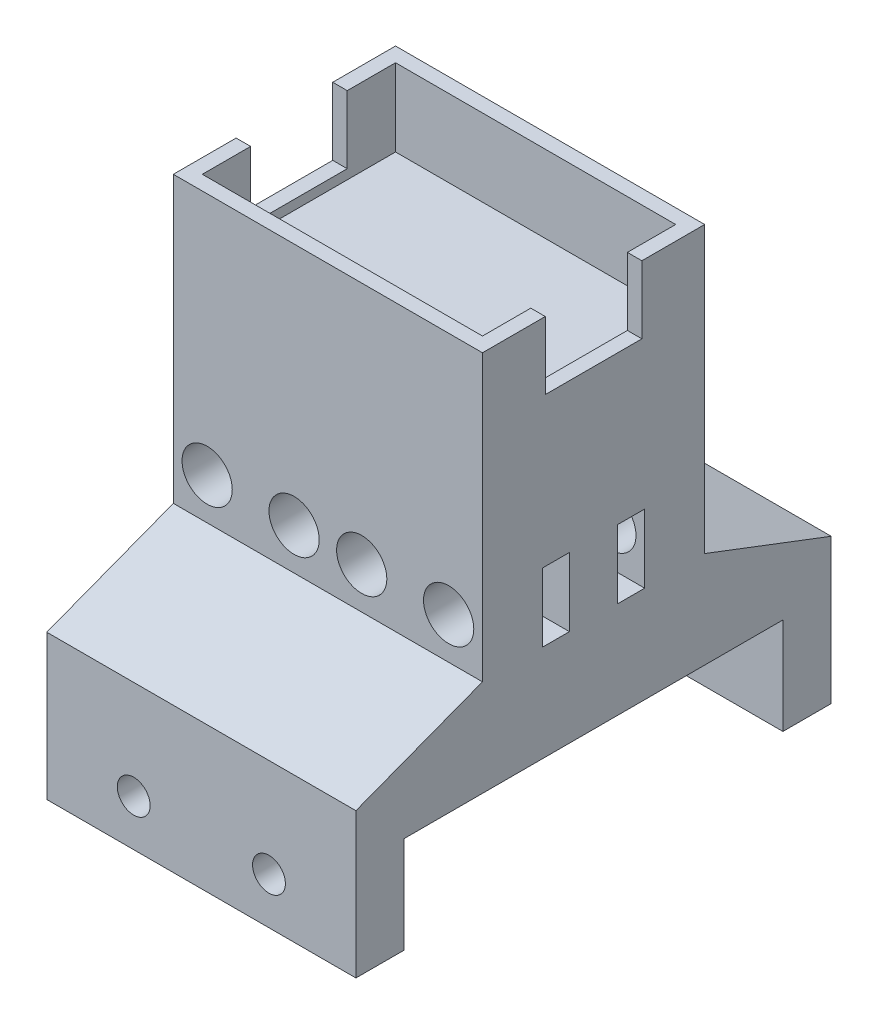
from build123d import *

# Parameters (mm, degrees)
SKETCH4_W           = 32
SKETCH4_H           = 23
BOSS_EXTRUDE3_DEPTH = 19.5
SKETCH5_W           = 29
SKETCH5_H           = 20
CUT_EXTRUDE2_DEPTH  = 8
SKETCH7_W           = 10
SKETCH7_H           = 7
CUT_EXTRUDE4_DEPTH  = 40.198214245
SKETCH8_W           = 32
SKETCH8_H           = 23
BOSS_EXTRUDE4_DEPTH = 10
SKETCH12_R          = 2.6
CUT_EXTRUDE5_DEPTH  = 7
CIRPATTERN1_COUNT   = 2
CIRPATTERN1_ANGLE   = 180
SKETCH13_W          = 15
SKETCH13_H          = 2.791622882
CUT_EXTRUDE6_DEPTH  = 7.1
SKETCH14_W          = 32
SKETCH14_H          = 23
BOSS_EXTRUDE5_DEPTH = 5
BOSS_EXTRUDE6_DEPTH = 32
SKETCH16_R          = 1.7
CUT_EXTRUDE7_DEPTH  = 60.805016512


with BuildPart() as part:
    # Sketch4 → Boss-Extrude3 (new body)
    with BuildSketch(Plane(origin=(0, 0, 0), x_dir=(1, 0, 0), z_dir=(0, 1, 0))):
        Rectangle(SKETCH4_W, SKETCH4_H)
    extrude(amount=BOSS_EXTRUDE3_DEPTH)

    # Sketch5 → Cut-Extrude2 (cut)
    with BuildSketch(Plane(origin=(0, 19.5, 0), x_dir=(1, 0, 0), z_dir=(0, 1, 0))):
        Rectangle(SKETCH5_W, SKETCH5_H)
    extrude(amount=-CUT_EXTRUDE2_DEPTH, mode=Mode.SUBTRACT)

    # Sketch7 → Cut-Extrude4 (cut, through all)
    with BuildSketch(Plane(origin=(16, 0, 0), x_dir=(0, 0, -1), z_dir=(1, 0, 0))):
        with Locations((0, 16)):
            Rectangle(SKETCH7_W, SKETCH7_H)
    extrude(amount=-CUT_EXTRUDE4_DEPTH, mode=Mode.SUBTRACT)

    # Sketch8 → Boss-Extrude4 (add)
    with BuildSketch(Plane(origin=(0, 0, 0), x_dir=(-1, 0, 0), z_dir=(0, -1, 0))):
        Rectangle(SKETCH8_W, SKETCH8_H)
    extrude(amount=BOSS_EXTRUDE4_DEPTH)

    # Sketch12 → Cut-Extrude5 (cut)
    with BuildSketch(Plane(origin=(0, 0, -11.5), x_dir=(-1, 0, 0), z_dir=(0, 0, -1))):
        with Locations((-12.5, -5.726898225)):
            Circle(SKETCH12_R)
        with Locations(Location((-3.5, -5.726898225, 0), (0, 0, 180))):
            Circle(SKETCH12_R)
        with Locations((3.5, -5.726898225)):
            Circle(SKETCH12_R)
        with Locations(Location((12.5, -5.726898225, 0), (0, 0, 180))):
            Circle(SKETCH12_R)
    cut_extrude5 = extrude(amount=-CUT_EXTRUDE5_DEPTH, mode=Mode.SUBTRACT)

    # CirPattern1: Cut-Extrude5 ×2 about axis
    cirpattern1_axis = Axis((0, 11.5, 0), (0, -1, 0))
    for i in range(1, CIRPATTERN1_COUNT):
        add(cut_extrude5.rotate(cirpattern1_axis, i * CIRPATTERN1_ANGLE / (CIRPATTERN1_COUNT - 1)), mode=Mode.SUBTRACT)

    # Sketch13 → Cut-Extrude6 (cut)
    with BuildSketch(Plane(origin=(0, -10, 0), x_dir=(-1, 0, 0), z_dir=(0, -1, 0))):
        with Locations((8.5, 3.895811441)):
            Rectangle(SKETCH13_W, SKETCH13_H)
        with Locations((-8.5, 3.895811441)):
            Rectangle(SKETCH13_W, SKETCH13_H)
        with Locations((-8.5, -3.895811441)):
            Rectangle(SKETCH13_W, SKETCH13_H)
        with Locations((8.5, -3.895811441)):
            Rectangle(SKETCH13_W, SKETCH13_H)
    extrude(amount=-CUT_EXTRUDE6_DEPTH, mode=Mode.SUBTRACT)

    # Sketch14 → Boss-Extrude5 (add)
    with BuildSketch(Plane(origin=(0, -10, 0), x_dir=(-1, 0, 0), z_dir=(0, -1, 0))):
        Rectangle(SKETCH14_W, SKETCH14_H)
    extrude(amount=BOSS_EXTRUDE5_DEPTH)

    # Sketch15 → Boss-Extrude6 (add)
    with BuildSketch(Plane.ZY.offset(16)):
        Polygon((-24.6, -15), (-24.6, -30), (-19.6, -30), (-19.6, -20), (19.6, -20), (19.6, -30), (24.6, -30), (24.6, -15), (11.5, -10), (11.5, -15), (-11.5, -15), (-11.5, -10), align=None)
    extrude(amount=-BOSS_EXTRUDE6_DEPTH)

    # Sketch16 → Cut-Extrude7 (cut, through all)
    with BuildSketch(Plane(origin=(0, 0, -24.6), x_dir=(-1, 0, 0), z_dir=(0, 0, -1))):
        with Locations((7, -25.2)):
            Circle(SKETCH16_R)
        with Locations((-7, -25.2)):
            Circle(SKETCH16_R)
    extrude(amount=-CUT_EXTRUDE7_DEPTH, mode=Mode.SUBTRACT)


solid = part.part
